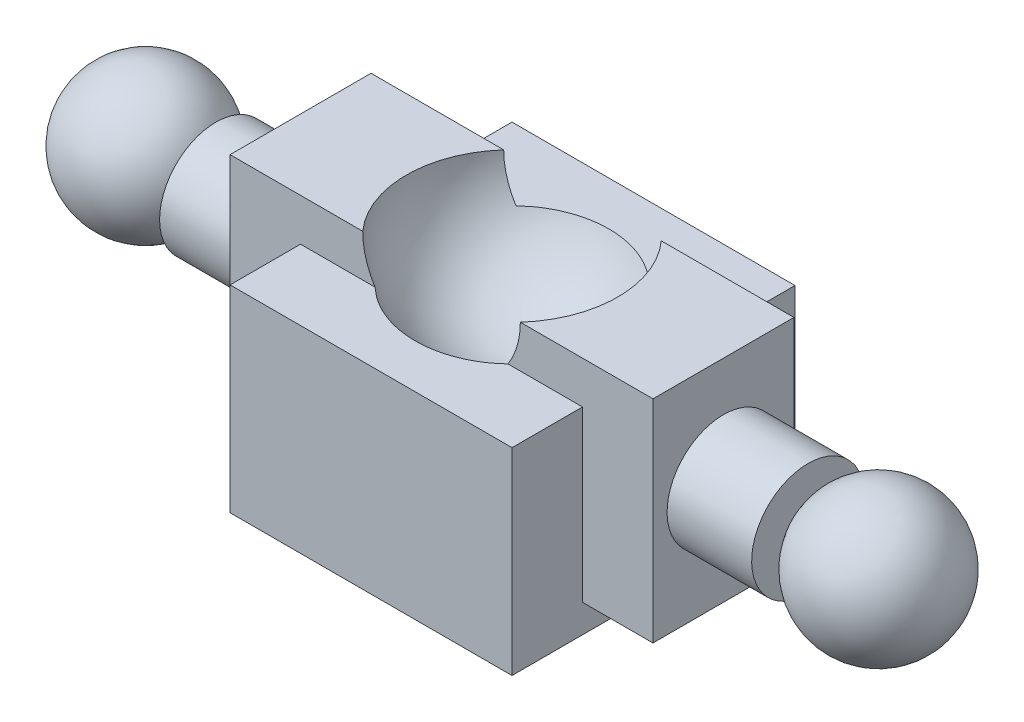
from build123d import *

# Parameters (mm, degrees)
SKETCH1_W            = 30
SKETCH1_H            = 15
BOSS_EXTRUDE1_DEPTH  = 10
SKETCH2_W            = 20
SKETCH2_H            = 14
BOSS_EXTRUDE2_DEPTH  = 5
SKETCH3_W            = 20.074773711
SKETCH3_H            = 14
BOSS_EXTRUDE3_DEPTH  = 5
SKETCH4_W            = 20
SKETCH4_H            = 10
BOSS_EXTRUDE4_DEPTH  = 2
SKETCH5_R            = 4
BOSS_EXTRUDE6_DEPTH  = 6
SKETCH6_R            = 4
BOSS_EXTRUDE7_DEPTH  = 6
SKETCH8_R            = 1.5
BOSS_EXTRUDE9_DEPTH  = 5
SKETCH10_R           = 1.5
BOSS_EXTRUDE10_DEPTH = 5


with BuildPart() as part:
    # Sketch1 → Boss-Extrude1 (new body)
    with BuildSketch(Plane.XY):
        with Locations((3.707224335, -2.680608365)):
            Rectangle(SKETCH1_W, SKETCH1_H)
    extrude(amount=BOSS_EXTRUDE1_DEPTH)

    # Sketch2 → Boss-Extrude2 (add)
    with BuildSketch(Plane.XY.offset(10)):
        with Locations((3.707224335, -5.180608365)):
            Rectangle(SKETCH2_W, SKETCH2_H)
    extrude(amount=BOSS_EXTRUDE2_DEPTH)

    # Sketch3 → Boss-Extrude3 (add)
    with BuildSketch(Plane(origin=(0, 0, 0), x_dir=(-1, 0, 0), z_dir=(0, 0, -1))):
        with Locations((-3.74461119, -5.180608365)):
            Rectangle(SKETCH3_W, SKETCH3_H)
    extrude(amount=BOSS_EXTRUDE3_DEPTH)

    # Sketch4 → Boss-Extrude4 (add)
    with BuildSketch(Plane.XZ.offset(10.180608365)):
        with Locations((3.707224335, 5)):
            Rectangle(SKETCH4_W, SKETCH4_H)
    extrude(amount=BOSS_EXTRUDE4_DEPTH)

    # Sketch5 → Boss-Extrude6 (add)
    with BuildSketch(Plane(origin=(18.707224335, 0, 0), x_dir=(0, 0, -1), z_dir=(1, 0, 0))):
        with Locations(Location((-5, -2.651445807, 0), (0, 0, 90))):
            Circle(SKETCH5_R)
    extrude(amount=BOSS_EXTRUDE6_DEPTH)

    # Sketch6 → Boss-Extrude7 (add)
    with BuildSketch(Plane.ZY.offset(11.292775665)):
        with Locations((5, -2.680608365)):
            Circle(SKETCH6_R)
    extrude(amount=BOSS_EXTRUDE7_DEPTH)

    # Sketch8 → Boss-Extrude9 (add)
    with BuildSketch(Plane.ZY.offset(17.292775665)):
        with Locations((5, -2.680608365)):
            Circle(SKETCH8_R)
    extrude(amount=BOSS_EXTRUDE9_DEPTH)

    # Sketch10 → Boss-Extrude10 (add)
    with BuildSketch(Plane(origin=(24.707224335, 0, 0), x_dir=(0, 0, -1), z_dir=(1, 0, 0))):
        with Locations(Location((-5, -2.651445807, 0), (0, 0, 90))):
            Circle(SKETCH10_R)
    extrude(amount=BOSS_EXTRUDE10_DEPTH)

    # Sketch9 → Revolve3 (revolve)
    with BuildSketch(Plane.ZY.offset(22.292775665)):
        with BuildLine():
            Line((5, 2.348554193), (5, -7.651445807))
            ThreePointArc((5, -7.651445807), (0, -2.651445807), (5, 2.348554193))
        make_face()
    revolve(axis=Axis((-22.292775665, 2.348554193, 5), (0, -1, 0)))

    # Sketch11 → Revolve4 (revolve)
    with BuildSketch(Plane(origin=(29.707224335, 0, 0), x_dir=(0, 0, -1), z_dir=(1, 0, 0))):
        with BuildLine():
            Line((-5, 2.348554193), (-5, -7.651445807))
            ThreePointArc((-5, -7.651445807), (-10, -2.651445807), (-5, 2.348554193))
        make_face()
    revolve(axis=Axis((29.707224335, 2.348554193, 5), (0, -1, 0)))

    # Sketch7 → Cut-Revolve2 (revolve, cut)
    with BuildSketch(Plane(origin=(0, 4.819391635, 0), x_dir=(1, 0, 0), z_dir=(0, 1, 0))):
        with BuildLine():
            Line((3.707224335, 2.5), (3.707224335, -12.5))
            ThreePointArc((3.707224335, -12.5), (-3.792775665, -5), (3.707224335, 2.5))
        make_face()
    revolve(axis=Axis((3.707224335, 4.819391635, -2.5), (0, 0, 1)), mode=Mode.SUBTRACT)


solid = part.part
